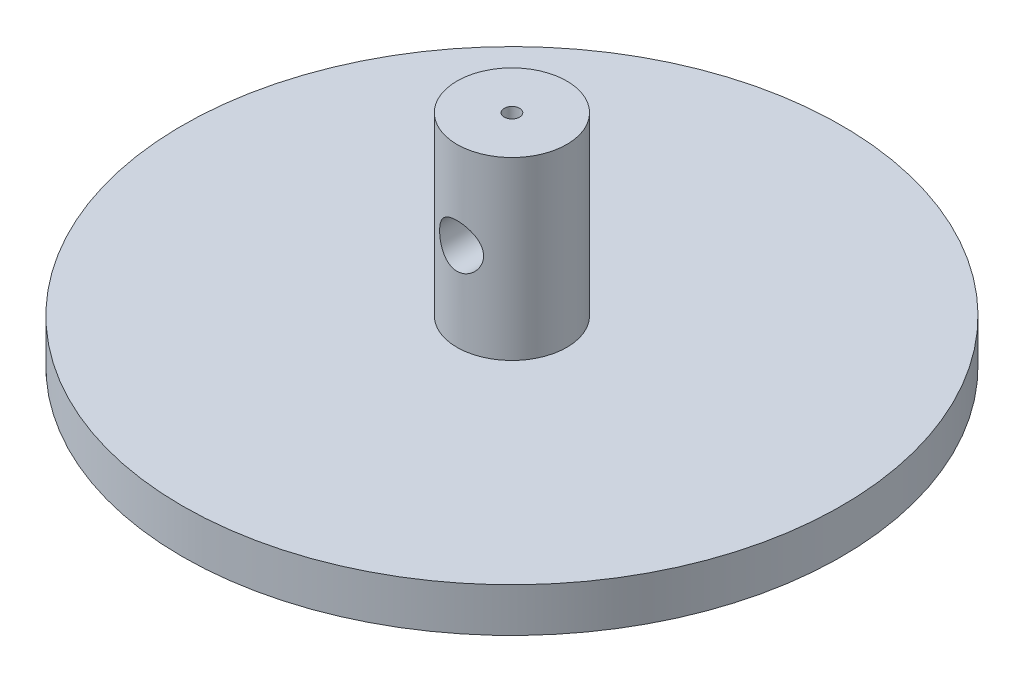
from build123d import *

# Parameters (mm, degrees)
SKETCH_1_R               = 15
EXTRUDE_1_DEPTH          = 2
SKETCH_1_7_R             = 2.5
EXTRUDE_2_DEPTH          = 10
SKETCH_2_R               = 0.35
CUT_EXTRUDE_1_DEPTH      = 4
CUT_EXTRUDE_3_DEPTH      = 24.452078799
CUT_EXTRUDE_3_DEPTH_BACK = 24.452078799
SKETCH_3_R               = 1


with BuildPart() as part:
    # 草图1 → 凸台-拉伸1 (new body)
    with BuildSketch(Plane(origin=(0, 0, 0), x_dir=(1, 0, 0), z_dir=(0, 1, 0))):
        Circle(SKETCH_1_R)
    extrude(amount=EXTRUDE_1_DEPTH)

    # 草图1<7> → 凸台-拉伸2 (add)
    with BuildSketch(Plane(origin=(0, 0, 0), x_dir=(1, 0, 0), z_dir=(0, 1, 0))):
        Circle(SKETCH_1_7_R)
    extrude(amount=EXTRUDE_2_DEPTH)

    # 草图2 → 切除-拉伸1 (cut)
    with BuildSketch(Plane(origin=(0, 10, 0), x_dir=(1, 0, 0), z_dir=(0, 1, 0))):
        Circle(SKETCH_2_R)
    extrude(amount=-CUT_EXTRUDE_1_DEPTH, mode=Mode.SUBTRACT)

    # 草图3 → 切除-拉伸3 (cut, two sides: drawn at the far end of the back side and taken through both)
    with BuildSketch(Plane.XY.offset(-CUT_EXTRUDE_3_DEPTH_BACK)):
        with Locations((0, 6)):
            Circle(SKETCH_3_R)
    extrude(amount=CUT_EXTRUDE_3_DEPTH + CUT_EXTRUDE_3_DEPTH_BACK, mode=Mode.SUBTRACT)


solid = part.part
